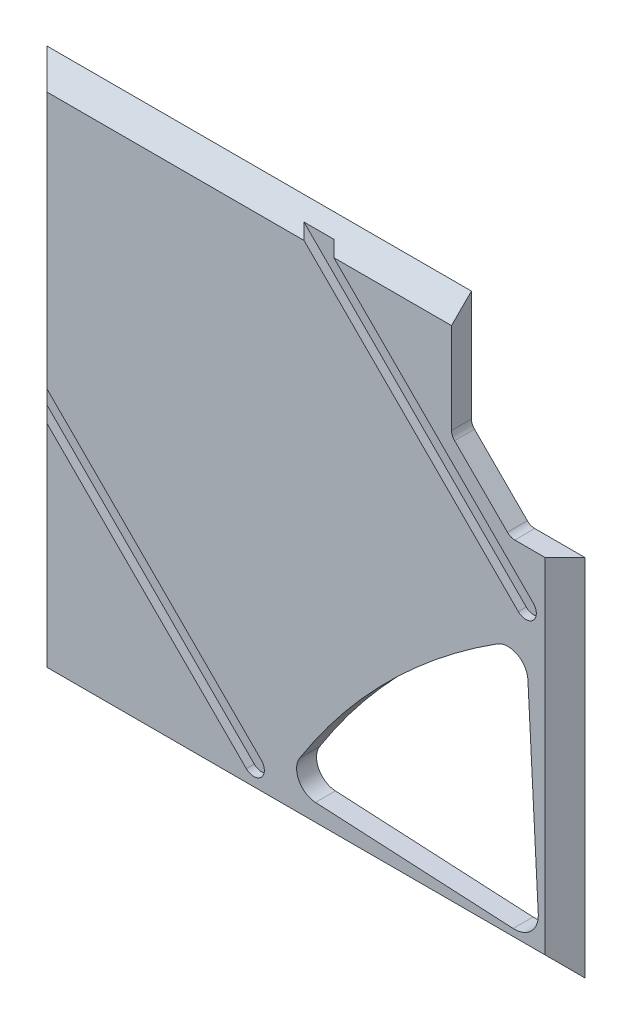
from build123d import *

# Parameters (mm, degrees)
SKETCH2_W           = 342.9
SKETCH2_H           = 342.9
BOSS_EXTRUDE2_DEPTH = 12.7
DRAFT2_ANGLE        = -45
CUT_EXTRUDE1_DEPTH  = 5.08
CUT_EXTRUDE2_DEPTH  = 243.799289538
CUT_EXTRUDE3_DEPTH  = 243.799289538


with BuildPart() as part:
    # Sketch2 → Boss-Extrude2 (new body)
    with BuildSketch(Plane.XY):
        Rectangle(SKETCH2_W, SKETCH2_H)
    extrude(amount=BOSS_EXTRUDE2_DEPTH)

    # Draft2
    draft2_faces = [part.faces().sort_by_distance(p)[0] for p in [
        (-171.45, 0, 6.35),
        (0, -171.45, 6.35),
        (171.45, 0, 6.35),
        (0, 171.45, 6.35),
    ]]
    draft(draft2_faces, Plane(origin=(0, 0, 0), x_dir=(-1, 0, 0), z_dir=(0, 0, -1)), DRAFT2_ANGLE)

    # Sketch3 → Cut-Extrude1 (cut)
    with BuildSketch(Plane.XY.offset(12.7)):
        with BuildLine():
            Line((-171.45, 7.650128352), (-22.188943137, -141.610928512))
            ThreePointArc((-22.188943137, -141.610928512), (-22.188943137, -151.13), (-31.708014625, -151.13))
            Line((-31.708014625, -151.13), (-171.45, -11.388014625))
            Line((-171.45, -11.388014625), (-171.45, 7.650128352))
        make_face()
        with BuildLine():
            Line((11.388014625, 171.45), (-7.650128352, 171.45))
            Line((-7.650128352, 171.45), (141.610928512, 22.188943137))
            ThreePointArc((141.610928512, 22.188943137), (151.13, 22.188943137), (151.13, 31.708014625))
            Line((151.13, 31.708014625), (11.388014625, 171.45))
        make_face()
    extrude(amount=-CUT_EXTRUDE1_DEPTH, mode=Mode.SUBTRACT)

    # Sketch4 → Cut-Extrude2 (cut, through all)
    with BuildSketch(Plane.XY.offset(12.7)):
        with BuildLine():
            Line((99.06, 171.45), (99.06, 100.881890785))
            ThreePointArc((99.06, 100.881890785), (99.562699567, 98.354649397), (100.994266817, 96.212157602))
            Line((100.994266817, 96.212157602), (134.693157602, 62.513266817))
            ThreePointArc((134.693157602, 62.513266817), (136.835649397, 61.081699567), (139.362890785, 60.579))
            Line((139.362890785, 60.579), (171.45, 60.579))
            Line((171.45, 60.579), (171.45, 171.45))
            Line((171.45, 171.45), (99.06, 171.45))
        make_face()
    extrude(amount=-CUT_EXTRUDE2_DEPTH, mode=Mode.SUBTRACT)

    # Sketch5 → Cut-Extrude3 (cut, through all)
    with BuildSketch(Plane(origin=(0, 0, 0), x_dir=(-1, 0, 0), z_dir=(0, 0, -1))):
        with BuildLine():
            Line((-154.340192074, -138.323477991), (-147.739346277, -12.371837087))
            ThreePointArc((-147.739346277, -12.371837087), (-140.887450687, -1.754086289), (-128.2628732, -2.30648873))
            ThreePointArc((-128.2628732, -2.30648873), (-58.298772875, -58.298772875), (-2.30648873, -128.2628732))
            ThreePointArc((-2.30648873, -128.2628732), (-1.754086289, -140.887450687), (-12.371837087, -147.739346277))
            Line((-12.371837087, -147.739346277), (-138.323477991, -154.340192074))
            ThreePointArc((-138.323477991, -154.340192074), (-149.897385309, -149.897385309), (-154.340192074, -138.323477991))
        make_face()
    extrude(amount=-CUT_EXTRUDE3_DEPTH, mode=Mode.SUBTRACT)


solid = part.part
